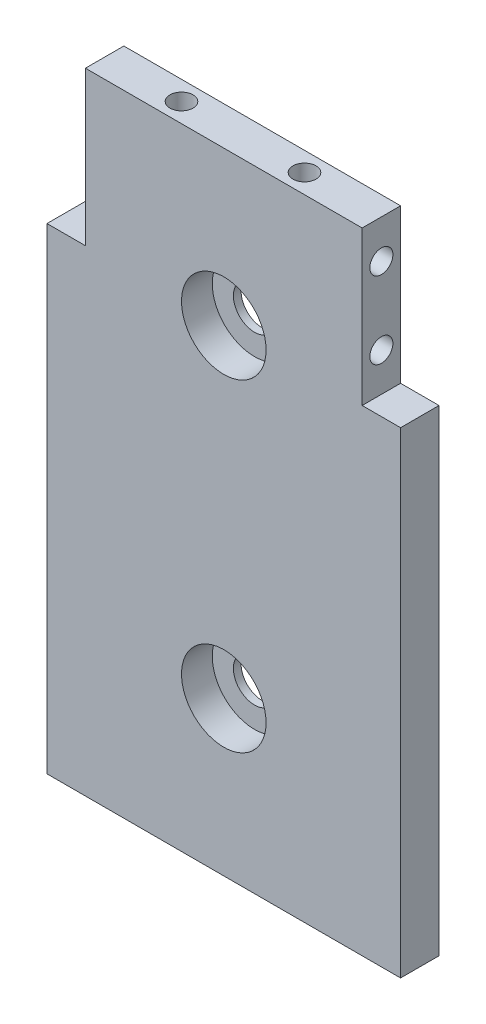
from build123d import *

# Parameters (mm, degrees)
SKETCH1_R           = 2.75
BOSS_EXTRUDE1_DEPTH = 5
SKETCH3_R           = 5.5
CUT_EXTRUDE2_DEPTH  = 4
SKETCH5_R           = 1.5
CUT_EXTRUDE3_DEPTH  = 7
SKETCH6_R           = 1.5
CUT_EXTRUDE4_DEPTH  = 7
CUT_EXTRUDE5_START  = -7
SKETCH7_R           = 1.5
CUT_EXTRUDE5_DEPTH  = 7
SKETCH8_R           = 1.5
CUT_EXTRUDE6_DEPTH  = 7


with BuildPart() as part:
    # Sketch1 → Boss-Extrude1 (new body)
    with BuildSketch(Plane.XY):
        Polygon((0, 42), (0, -20), (46, -20), (46, 42), (41, 42), (41, 62), (5, 62), (5, 42), align=None)
        with Locations((23, 42)):
            Circle(SKETCH1_R, mode=Mode.SUBTRACT)
        with Locations((23, 0)):
            Circle(SKETCH1_R, mode=Mode.SUBTRACT)
    extrude(amount=BOSS_EXTRUDE1_DEPTH)

    # Sketch3 → Cut-Extrude2 (cut)
    with BuildSketch(Plane.XY.offset(5)):
        with Locations((23, 42)):
            Circle(SKETCH3_R)
        with Locations((23, 0)):
            Circle(SKETCH3_R)
    extrude(amount=-CUT_EXTRUDE2_DEPTH, mode=Mode.SUBTRACT)

    # Sketch5 → Cut-Extrude3 (cut)
    with BuildSketch(Plane.XZ.offset(20)):
        with Locations(Location((5, 2.5, 0), (0, 0, 270))):
            Circle(SKETCH5_R)
        with Locations(Location((41, 2.5, 0), (0, 0, 270))):
            Circle(SKETCH5_R)
    extrude(amount=-CUT_EXTRUDE3_DEPTH, mode=Mode.SUBTRACT)

    # Sketch6 → Cut-Extrude4 (cut)
    with BuildSketch(Plane.ZY.offset(-5)):
        with Locations((2.5, 47)):
            Circle(SKETCH6_R)
        with Locations((2.5, 57)):
            Circle(SKETCH6_R)
    extrude(amount=-CUT_EXTRUDE4_DEPTH, mode=Mode.SUBTRACT)

    # Sketch7 → Cut-Extrude5 (cut)
    with BuildSketch(Plane(origin=(41, 0, 0), x_dir=(0, 0, -1), z_dir=(1, 0, 0)).offset(CUT_EXTRUDE5_START)):
        with Locations(Location((-2.5, 47, 0), (0, 0, 180))):
            Circle(SKETCH7_R)
        with Locations(Location((-2.5, 57, 0), (0, 0, 180))):
            Circle(SKETCH7_R)
    extrude(amount=CUT_EXTRUDE5_DEPTH, mode=Mode.SUBTRACT)

    # Sketch8 → Cut-Extrude6 (cut)
    with BuildSketch(Plane(origin=(0, 62, 0), x_dir=(1, 0, 0), z_dir=(0, 1, 0))):
        with Locations(Location((15, -2.5, 0), (0, 0, 270))):
            Circle(SKETCH8_R)
        with Locations(Location((31, -2.5, 0), (0, 0, 270))):
            Circle(SKETCH8_R)
    extrude(amount=-CUT_EXTRUDE6_DEPTH, mode=Mode.SUBTRACT)


solid = part.part
